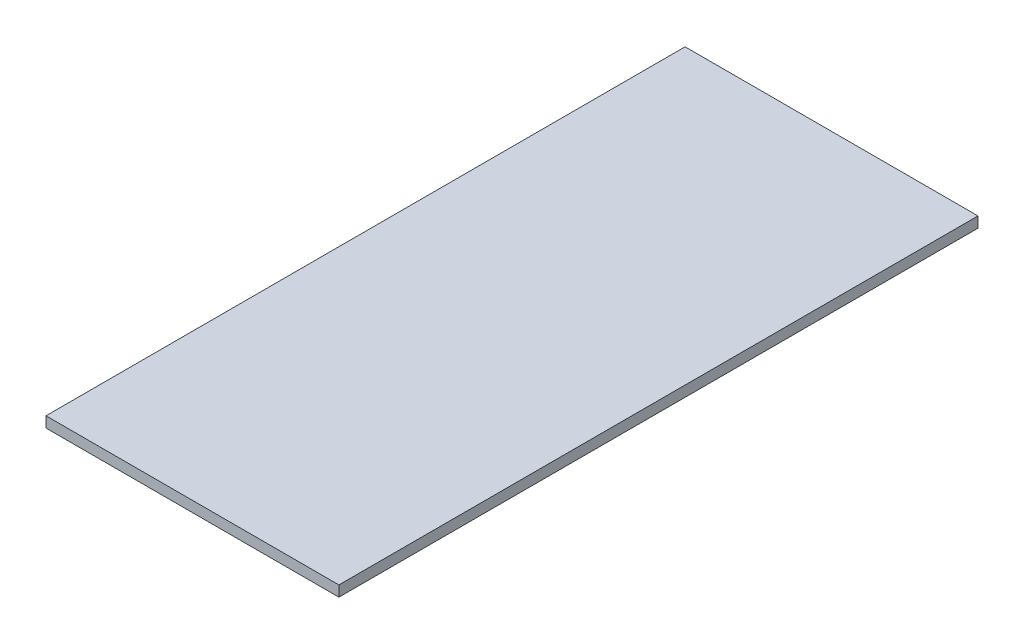
from build123d import *

# Parameters (mm, degrees)
SKETCH1_W           = 550
SKETCH1_H           = 1200
BOSS_EXTRUDE1_DEPTH = 20


with BuildPart() as part:
    # Sketch1 → Boss-Extrude1 (new body)
    with BuildSketch(Plane(origin=(0, 0, 0), x_dir=(1, 0, 0), z_dir=(0, 1, 0))):
        with Locations((245, 547.651006711)):
            Rectangle(SKETCH1_W, SKETCH1_H)
    extrude(amount=BOSS_EXTRUDE1_DEPTH)


solid = part.part
